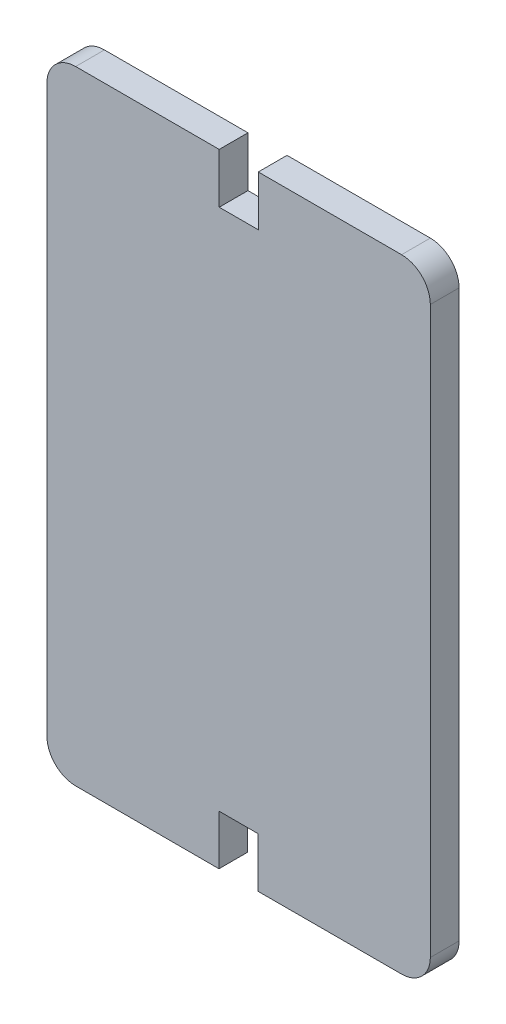
from build123d import *

# Parameters (mm, degrees)
BOSS_EXTRUDE1_DEPTH = 3


with BuildPart() as part:
    # Sketch1 → Boss-Extrude1 (new body)
    with BuildSketch(Plane.XY):
        with BuildLine():
            Line((3, 0), (17.95, -0.01))
            Line((17.95, -0.01), (17.95, 5.2))
            Line((17.95, 5.2), (22.025, 5.2))
            Line((22.025, 5.2), (22.025, -0.01))
            Line((22.025, -0.01), (37, 0))
            ThreePointArc((37, 0), (39.121320344, 0.878679656), (40, 3))
            Line((40, 3), (40, 62))
            ThreePointArc((40, 62), (39.121320344, 64.121320344), (37, 65))
            Line((37, 65), (22.05, 65))
            Line((22.05, 65), (22.05, 59.775))
            Line((22.05, 59.775), (17.975, 59.775))
            Line((17.975, 59.775), (17.975, 65))
            Line((17.975, 65), (3, 65))
            ThreePointArc((3, 65), (0.878679656, 64.121320344), (0, 62))
            Line((0, 62), (0, 3))
            ThreePointArc((0, 3), (0.878679656, 0.878679656), (3, 0))
        make_face()
    extrude(amount=BOSS_EXTRUDE1_DEPTH)


solid = part.part
